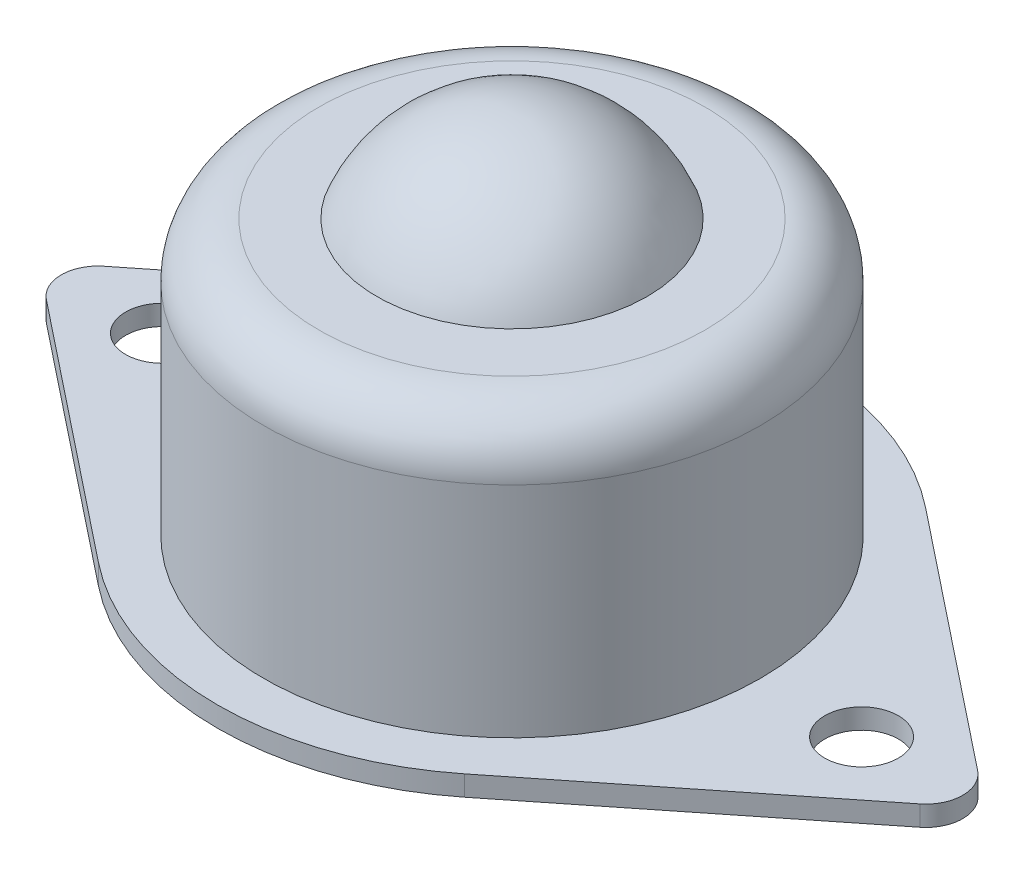
from build123d import *

# Parameters (mm, degrees)
SKETCH_1_R      = 2
EXTRUDE_1_DEPTH = 1.1


with BuildPart() as part:
    # 草图1 → 凸台-拉伸1 (new body)
    with BuildSketch(Plane(origin=(0, 0, 0), x_dir=(1, 0, 0), z_dir=(0, 1, 0))):
        with BuildLine():
            Line((-9.955555556, 12.525450634), (-23.744444444, 1.565681329))
            ThreePointArc((-23.744444444, 1.565681329), (-24.5, 0), (-23.744444444, -1.565681329))
            Line((-23.744444444, -1.565681329), (-9.955555556, -12.525450634))
            ThreePointArc((-9.955555556, -12.525450634), (0, -16), (9.955555556, -12.525450634))
            Line((9.955555556, -12.525450634), (23.744444444, -1.565681329))
            ThreePointArc((23.744444444, -1.565681329), (24.5, 0), (23.744444444, 1.565681329))
            Line((23.744444444, 1.565681329), (9.955555556, 12.525450634))
            ThreePointArc((9.955555556, 12.525450634), (0, 16), (-9.955555556, 12.525450634))
        make_face()
        with Locations(Location((-19, 0, 0), (0, 0, 270))):
            Circle(SKETCH_1_R, mode=Mode.SUBTRACT)
        with Locations(Location((19, 0, 0), (0, 0, 90))):
            Circle(SKETCH_1_R, mode=Mode.SUBTRACT)
    extrude(amount=EXTRUDE_1_DEPTH)

    # 草图2 → 旋转1 (revolve)
    with BuildSketch(Plane.XY, mode=Mode.PRIVATE) as revolve_1_sk:
        with BuildLine():
            Line((0, 1.1), (-13.5, 1.1))
            Line((-13.5, 1.1), (-13.5, 13))
            ThreePointArc((-13.5, 13), (-12.621320344, 15.121320344), (-10.5, 16))
            Line((-10.5, 16), (-7.348469228, 16))
            ThreePointArc((-7.348469228, 16), (-4.444097209, 19.631462317), (0, 21))
            Line((0, 21), (0, 1.1))
        make_face()
    revolve(revolve_1_sk.sketch.rotate(Axis((0, 1.1, 0), (0, 1, 0)), 180), axis=Axis((0, 1.1, 0), (0, 1, 0)))


solid = part.part
